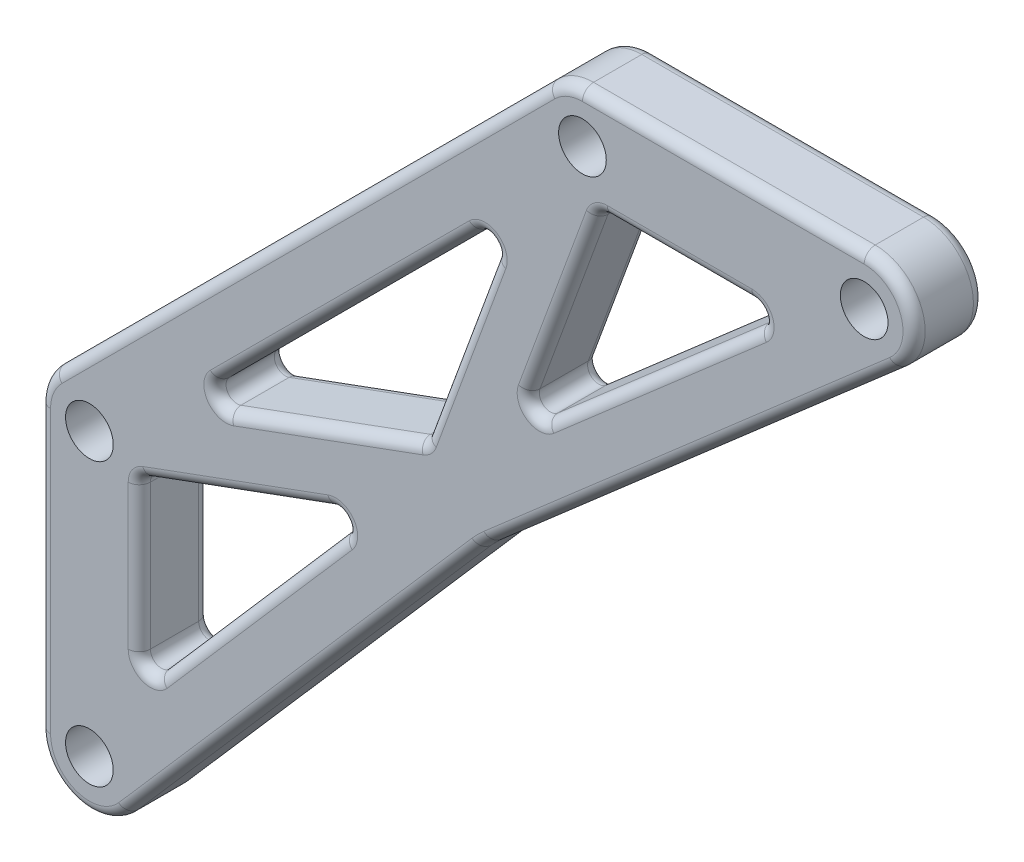
from build123d import *

# Parameters (mm, degrees)
SKETCH1_R           = 4.5
SKETCH1_R_2         = 2.15
BOSS_EXTRUDE1_DEPTH = 6.35
FILLET1_R           = 1
FILLET2_R           = 10
FILLET3_R           = 1


with BuildPart() as part:
    # Sketch1 → Boss-Extrude1 (new body)
    # profile 1 of 5: a face of its own
    with BuildSketch(Plane.XY):
        with BuildLine():
            ThreePointArc((4.5, 25.4), (0, 20.9), (-4.5, 25.4))
            Line((-4.5, 25.4), (-4.5, 0))
            ThreePointArc((-4.5, 0), (0, 4.5), (4.5, 0))
            ThreePointArc((4.5, 0), (4.214337436, -1.577770571), (3.393617788, -2.955225593))
            Line((3.393617788, -2.955225593), (35.702961005, 34.147038995))
            Line((35.702961005, 34.147038995), (72.805225593, 66.456382212))
            ThreePointArc((72.805225593, 66.456382212), (65.635662564, 68.272229429), (69.85, 74.35))
            Line((69.85, 74.35), (44.45, 74.35))
            ThreePointArc((44.45, 74.35), (47.631980515, 73.031980515), (48.95, 69.85))
            ThreePointArc((48.95, 69.85), (42.727924554, 65.692542104), (41.268019485, 73.031980515))
            Line((41.268019485, 73.031980515), (-3.181980515, 28.581980515))
            ThreePointArc((-3.181980515, 28.581980515), (1.722075446, 29.557457896), (4.5, 25.4))
        make_face()
        Polygon((4.5, 7.451640951), (4.5, 23.856291875), (25.498859745, 31.565571248), align=None, mode=Mode.SUBTRACT)
        Polygon((30.175813365, 39.674186635), (8.401557674, 31.68023733), (38.16976267, 61.448442326), align=None, mode=Mode.SUBTRACT)
        Polygon((38.284428752, 44.351140255), (45.993708125, 65.35), (62.398359049, 65.35), align=None, mode=Mode.SUBTRACT)
    # profile 2 of 5: a face of its own
    with BuildSketch(Plane.XY):
        Circle(SKETCH1_R)
        Circle(SKETCH1_R_2, mode=Mode.SUBTRACT)
    # profile 3 of 5: a face of its own
    with BuildSketch(Plane.XY):
        with Locations((0, 25.4)):
            Circle(SKETCH1_R)
        with Locations((0, 25.4)):
            Circle(SKETCH1_R_2, mode=Mode.SUBTRACT)
    # profile 4 of 5: a face of its own
    with BuildSketch(Plane.XY):
        with Locations((44.45, 69.85)):
            Circle(SKETCH1_R)
        with Locations((44.45, 69.85)):
            Circle(SKETCH1_R_2, mode=Mode.SUBTRACT)
    # profile 5 of 5: a face of its own
    with BuildSketch(Plane.XY):
        with Locations((69.85, 69.85)):
            Circle(SKETCH1_R)
        with Locations((69.85, 69.85)):
            Circle(SKETCH1_R_2, mode=Mode.SUBTRACT)
    extrude(amount=BOSS_EXTRUDE1_DEPTH)

    # Fillet1
    fillet1_edges = [part.edges().sort_by_distance(p)[0] for p in [
        (4.5, 23.856291875, 3.175),
        (4.5, 7.451640951, 3.175),
        (25.498859745, 31.565571248, 3.175),
        (8.401557674, 31.68023733, 3.175),
        (30.175813365, 39.674186635, 3.175),
        (38.16976267, 61.448442326, 3.175),
        (45.993708125, 65.35, 3.175),
        (38.284428752, 44.351140255, 3.175),
        (62.398359049, 65.35, 3.175),
    ]]
    fillet(fillet1_edges, radius=FILLET1_R)

    # Fillet2
    fillet2_edges = [part.edges().sort_by_distance(p)[0] for p in [
        (35.702961005, 34.147038995, 3.175),
    ]]
    fillet(fillet2_edges, radius=FILLET2_R)

    # Fillet3
    fillet3_edges = [part.edges().sort_by_distance(p)[0] for p in [
        (5.149384317, 9.186192659, 6.35),
        (4.68004977, 23.730593079, 0),
        (4.68004977, 23.730593079, 6.35),
        (-4.5, 12.7, 6.35),
        (35.71979839, 34.13020161, 0),
        (35.71979839, 34.13020161, 6.35),
        (-1.577770571, -4.214337436, 6.35),
        (19.321555564, 15.335538095, 6.35),
        (54.514461905, 50.528444436, 6.35),
        (74.064337436, 71.427770571, 6.35),
        (-4.157457896, 27.122075446, 0),
        (19.043019485, 50.806980515, 0),
        (42.727924554, 74.007457896, 0),
        (57.15, 74.35, 0),
        (74.064337436, 71.427770571, 0),
        (54.514461905, 50.528444436, 0),
        (19.321555564, 15.335538095, 0),
        (-1.577770571, -4.214337436, 0),
        (-4.5, 12.7, 0),
        (57.15, 74.35, 6.35),
        (42.727924554, 74.007457896, 6.35),
        (19.043019485, 50.806980515, 6.35),
        (-4.157457896, 27.122075446, 6.35),
        (50.803311958, 55.252816977, 0),
        (50.803311958, 55.252816977, 6.35),
        (53.209564824, 65.35, 0),
        (53.209564824, 65.35, 6.35),
        (42.690135952, 56.351591025, 0),
        (42.690135952, 56.351591025, 6.35),
        (21.202633056, 36.379876625, 0),
        (21.202633056, 36.379876625, 6.35),
        (33.470123375, 48.647366944, 0),
        (33.470123375, 48.647366944, 6.35),
        (23.285660172, 46.564339828, 0),
        (23.285660172, 46.564339828, 6.35),
        (14.597183023, 19.046688042, 0),
        (14.597183023, 19.046688042, 6.35),
        (13.498408975, 27.159864048, 0),
        (13.498408975, 27.159864048, 6.35),
        (4.5, 16.640435176, 0),
        (4.5, 16.640435176, 6.35),
        (60.663807341, 64.700615683, 0),
        (60.663807341, 64.700615683, 6.35),
        (39.998707708, 46.840324789, 0),
        (39.998707708, 46.840324789, 6.35),
        (46.119406921, 65.16995023, 0),
        (46.119406921, 65.16995023, 6.35),
        (30.103723379, 39.746276621, 0),
        (30.103723379, 39.746276621, 6.35),
        (36.204631828, 58.373266186, 0),
        (36.204631828, 58.373266186, 6.35),
        (11.476733814, 33.645368172, 0),
        (11.476733814, 33.645368172, 6.35),
        (23.009675211, 29.851292292, 0),
        (23.009675211, 29.851292292, 6.35),
        (5.149384317, 9.186192659, 0),
    ]]
    fillet(fillet3_edges, radius=FILLET3_R)


solid = part.part
